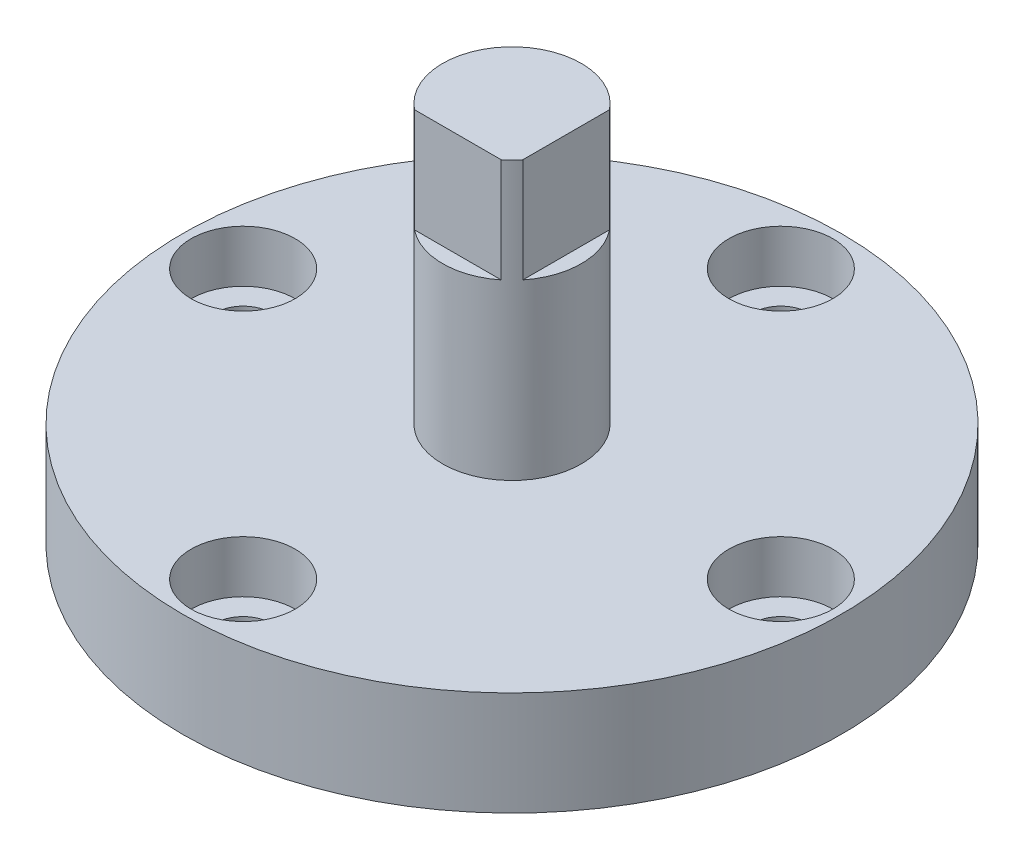
from build123d import *

# Parameters (mm, degrees)
SKETCH1_R           = 19
SKETCH1_R_2         = 3
BOSS_EXTRUDE1_DEPTH = 3
SKETCH2_R           = 4
BOSS_EXTRUDE2_DEPTH = 16
CUT_EXTRUDE1_START  = -6
CUT_EXTRUDE1_DEPTH  = 6
BOSS_EXTRUDE3_START = 3
SKETCH5_R           = 19
SKETCH5_R_2         = 1.6
BOSS_EXTRUDE3_DEPTH = 3


with BuildPart() as part:
    # Sketch1 → Boss-Extrude1 (new body)
    with BuildSketch(Plane(origin=(0, 0, 0), x_dir=(1, 0, 0), z_dir=(0, 1, 0))):
        with Locations(Location((0, 0, 0), (0, 0, 270))):
            Circle(SKETCH1_R)
        with Locations(Location((0, 15.5, 0), (0, 0, 270))):
            Circle(SKETCH1_R_2, mode=Mode.SUBTRACT)
        with Locations(Location((15.5, 0, 0), (0, 0, 270))):
            Circle(SKETCH1_R_2, mode=Mode.SUBTRACT)
        with Locations(Location((0, -15.5, 0), (0, 0, 270))):
            Circle(SKETCH1_R_2, mode=Mode.SUBTRACT)
        with Locations(Location((-15.5, 0, 0), (0, 0, 270))):
            Circle(SKETCH1_R_2, mode=Mode.SUBTRACT)
    extrude(amount=BOSS_EXTRUDE1_DEPTH)

    # Sketch2 → Boss-Extrude2 (add)
    with BuildSketch(Plane(origin=(0, 3, 0), x_dir=(1, 0, 0), z_dir=(0, 1, 0))):
        with Locations(Location((0, 0, 0), (0, 0, 270))):
            Circle(SKETCH2_R)
    extrude(amount=BOSS_EXTRUDE2_DEPTH)

    # Sketch4 → Cut-Extrude1 (cut)
    with BuildSketch(Plane(origin=(0, 19, 0), x_dir=(1, 0, 0), z_dir=(0, 1, 0)).offset(CUT_EXTRUDE1_START)):
        with BuildLine():
            Line((-2.5, -3.122498999), (2.5, -3.122498999))
            ThreePointArc((2.5, -3.122498999), (0, -4), (-2.5, -3.122498999))
        make_face()
        with BuildLine():
            Line((3.122498999, 2.5), (3.122498999, -2.5))
            ThreePointArc((3.122498999, -2.5), (4, 0), (3.122498999, 2.5))
        make_face()
    extrude(amount=CUT_EXTRUDE1_DEPTH, mode=Mode.SUBTRACT)

    # Sketch5 → Boss-Extrude3 (add)
    with BuildSketch(Plane.XZ.offset(BOSS_EXTRUDE3_START)):
        with Locations(Location((0, 0, 0), (0, 0, 270))):
            Circle(SKETCH5_R)
        with Locations(Location((0, 15.5, 0), (0, 0, 270))):
            Circle(SKETCH5_R_2, mode=Mode.SUBTRACT)
        with Locations(Location((-15.5, 0, 0), (0, 0, 270))):
            Circle(SKETCH5_R_2, mode=Mode.SUBTRACT)
        with Locations(Location((0, -15.5, 0), (0, 0, 270))):
            Circle(SKETCH5_R_2, mode=Mode.SUBTRACT)
        with Locations(Location((15.5, 0, 0), (0, 0, 270))):
            Circle(SKETCH5_R_2, mode=Mode.SUBTRACT)
    extrude(amount=-BOSS_EXTRUDE3_DEPTH)


solid = part.part
